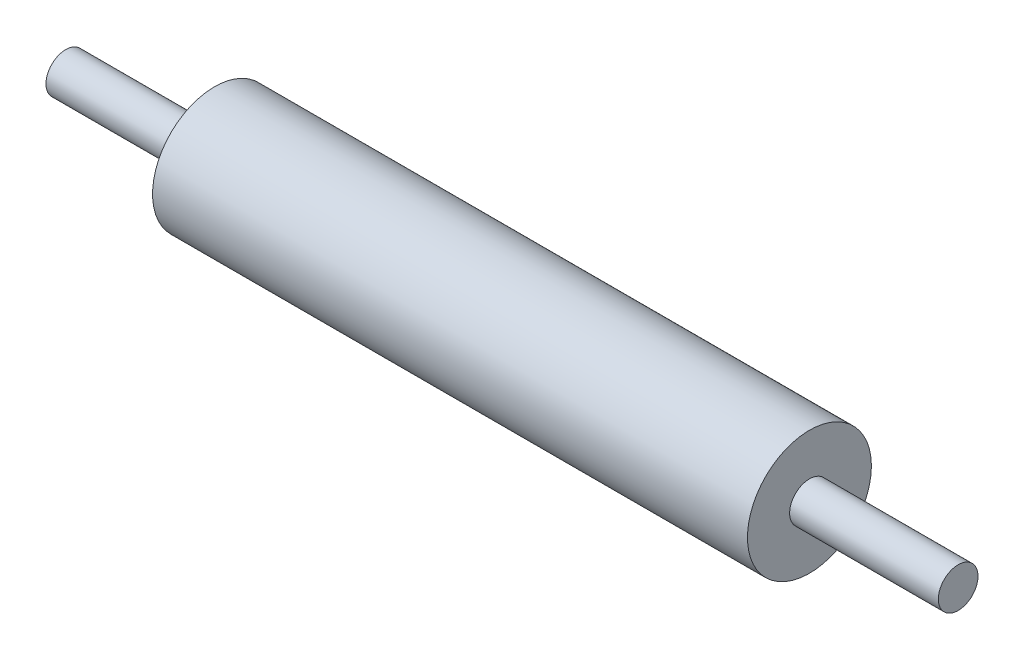
from build123d import *

# Parameters (mm, degrees)
SK_FUSE_HOLDER_BODY_R  = 5
FUSE_HOLDER_BODY_DEPTH = 48
LEAD_START             = -12
SK_LEAD_IN_R           = 1.6
LEAD_IN_DEPTH          = 12
LEAD_START_2           = 48
SK_LEAD_OUT_R          = 1.6
LEAD_OUT_DEPTH         = 12


with BuildPart() as part:
    # SK Fuse holder body → Fuse holder body (new body)
    with BuildSketch(Plane(origin=(0, 0, 0), x_dir=(0, 0, -1), z_dir=(1, 0, 0))):
        Circle(SK_FUSE_HOLDER_BODY_R)
    extrude(amount=FUSE_HOLDER_BODY_DEPTH)


with BuildPart() as body_2:
    # SK Lead in → Lead in (new body)
    with BuildSketch(Plane(origin=(0, 0, 0), x_dir=(0, 0, -1), z_dir=(1, 0, 0)).offset(LEAD_START)):
        Circle(SK_LEAD_IN_R)
    extrude(amount=LEAD_IN_DEPTH)


with BuildPart() as body_3:
    # SK Lead out → Lead out (new body)
    with BuildSketch(Plane(origin=(0, 0, 0), x_dir=(0, 0, -1), z_dir=(1, 0, 0)).offset(LEAD_START_2)):
        Circle(SK_LEAD_OUT_R)
    extrude(amount=LEAD_OUT_DEPTH)


solid = Compound([part.part, body_2.part, body_3.part])
